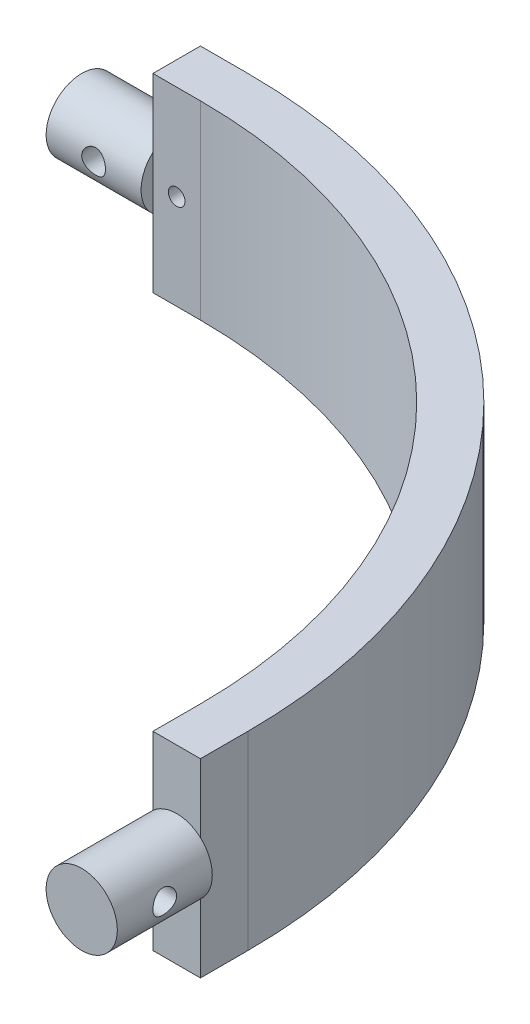
from build123d import *

# Parameters (mm, degrees)
BOSS_EXTRUDE1_DEPTH = 25.4
SKETCH2_W           = 12.7
SKETCH2_H           = 50.8
BOSS_EXTRUDE2_DEPTH = 12.7
SKETCH3_W           = 12.7
SKETCH3_H           = 50.8
BOSS_EXTRUDE3_DEPTH = 12.7
SKETCH4_R           = 9.525
BOSS_EXTRUDE4_DEPTH = 25.4
SKETCH5_R           = 3.175
CUT_EXTRUDE1_DEPTH  = 19.05
SKETCH6_R           = 9.525
BOSS_EXTRUDE5_DEPTH = 25.4
SKETCH7_R           = 3.175
CUT_EXTRUDE2_DEPTH  = 19.05
SKETCH8_R           = 2.2225
CUT_EXTRUDE3_DEPTH  = 11.43
SKETCH9_R           = 2.2225
CUT_EXTRUDE4_DEPTH  = 11.43


with BuildPart() as part:
    # Sketch1 → Boss-Extrude1 (new, symmetric)
    with BuildSketch(Plane(origin=(0, 0, 0), x_dir=(1, 0, 0), z_dir=(0, 1, 0))):
        with BuildLine():
            Line((0, 152.4), (0, 139.7))
            ThreePointArc((0, 139.7), (98.782817332, 98.782817332), (139.7, 0))
            Line((139.7, 0), (152.4, 0))
            ThreePointArc((152.4, 0), (107.763073453, 107.763073453), (0, 152.4))
        make_face()
    extrude(amount=BOSS_EXTRUDE1_DEPTH, both=True)

    # Sketch2 → Boss-Extrude2 (add)
    with BuildSketch(Plane.ZY):
        with Locations((-146.05, 0)):
            Rectangle(SKETCH2_W, SKETCH2_H)
    extrude(amount=BOSS_EXTRUDE2_DEPTH)

    # Sketch3 → Boss-Extrude3 (add)
    with BuildSketch(Plane.XY):
        with Locations((146.05, 0)):
            Rectangle(SKETCH3_W, SKETCH3_H)
    extrude(amount=BOSS_EXTRUDE3_DEPTH)

    # Sketch4 → Boss-Extrude4 (add)
    with BuildSketch(Plane.ZY.offset(12.7)):
        with Locations(Location((-146.05, 0, 0), (0, 0, 131.810314896))):
            Circle(SKETCH4_R)
    extrude(amount=BOSS_EXTRUDE4_DEPTH)

    # Sketch5 → Cut-Extrude1 (cut, symmetric)
    with BuildSketch(Plane.XY.offset(-139.7)):
        with Locations((-25.4, 0)):
            Circle(SKETCH5_R)
    extrude(amount=CUT_EXTRUDE1_DEPTH, both=True, mode=Mode.SUBTRACT)

    # Sketch6 → Boss-Extrude5 (add)
    with BuildSketch(Plane.XY.offset(12.7)):
        with Locations(Location((146.05, 0, 0), (0, 0, 131.810314896))):
            Circle(SKETCH6_R)
    extrude(amount=BOSS_EXTRUDE5_DEPTH)

    # Sketch7 → Cut-Extrude2 (cut, symmetric)
    with BuildSketch(Plane.ZY.offset(-139.7)):
        with Locations((25.4, 0)):
            Circle(SKETCH7_R)
    extrude(amount=CUT_EXTRUDE2_DEPTH, both=True, mode=Mode.SUBTRACT)

    # Sketch8 → Cut-Extrude3 (cut)
    with BuildSketch(Plane.XY.offset(-139.7)):
        with Locations((-6.35, 0)):
            Circle(SKETCH8_R)
    extrude(amount=-CUT_EXTRUDE3_DEPTH, mode=Mode.SUBTRACT)

    # Sketch9 → Cut-Extrude4 (cut)
    with BuildSketch(Plane.ZY.offset(-139.7)):
        with Locations((6.35, 0)):
            Circle(SKETCH9_R)
    extrude(amount=-CUT_EXTRUDE4_DEPTH, mode=Mode.SUBTRACT)


solid = part.part
